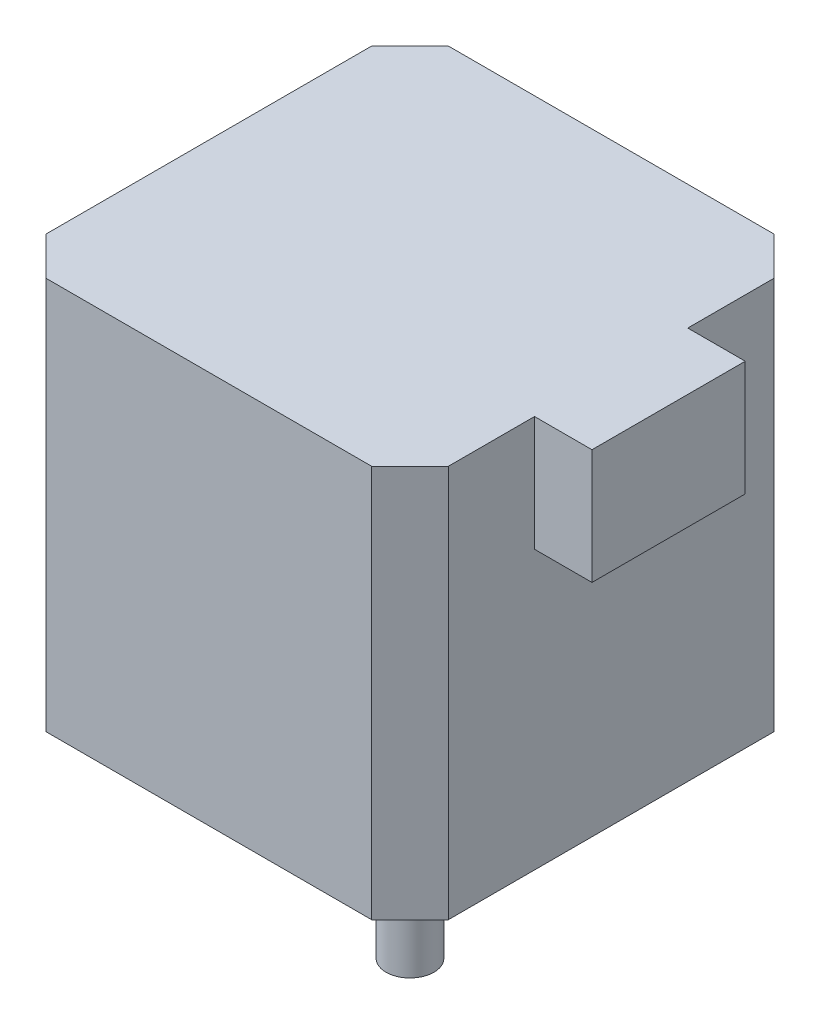
from build123d import *

# Parameters (mm, degrees)
SKETCH1_W                   = 42
SKETCH1_H                   = 42
BOSS_EXTRUDE1_DEPTH         = 41
CHAMFER1_SIZE               = 4
SKETCH2_R                   = 11
BOSS_EXTRUDE2_DEPTH         = 1.7
SKETCH3_R                   = 2.5
BOSS_EXTRUDE3_DEPTH         = 22.5
SKETCH4_W                   = 16
SKETCH4_H                   = 12
BOSS_EXTRUDE4_DEPTH         = 6
TAP_DRILL_FOR_M3_TAP1_D     = 2.5
TAP_DRILL_FOR_M3_TAP1_DEPTH = 8
TAP_DRILL_FOR_M3_TAP1_TIP   = 0.751075774


with BuildPart() as part:
    # Sketch1 → Boss-Extrude1 (new body)
    with BuildSketch(Plane(origin=(0, 0, 0), x_dir=(1, 0, 0), z_dir=(0, 1, 0))):
        Rectangle(SKETCH1_W, SKETCH1_H)
    extrude(amount=BOSS_EXTRUDE1_DEPTH)

    # Chamfer1
    chamfer1_edges = [part.edges().sort_by_distance(p)[0] for p in [
        (21, 20.5, 21),
        (-21, 20.5, 21),
        (-21, 20.5, -21),
        (21, 20.5, -21),
    ]]
    chamfer(chamfer1_edges, length=CHAMFER1_SIZE)

    # Sketch2 → Boss-Extrude2 (add)
    with BuildSketch(Plane(origin=(0, 0, 0), x_dir=(1, 0, 0), z_dir=(0, 1, 0))):
        with Locations(Location((0, 0, 0), (0, 0, 270))):
            Circle(SKETCH2_R)
    extrude(amount=-BOSS_EXTRUDE2_DEPTH)

    # Sketch3 → Boss-Extrude3 (add)
    with BuildSketch(Plane(origin=(0, 0, 0), x_dir=(1, 0, 0), z_dir=(0, 1, 0))):
        with Locations(Location((0, 0, 0), (0, 0, 270))):
            Circle(SKETCH3_R)
    extrude(amount=-BOSS_EXTRUDE3_DEPTH)

    # Sketch4 → Boss-Extrude4 (add)
    with BuildSketch(Plane(origin=(21, 0, 0), x_dir=(0, 0, -1), z_dir=(1, 0, 0))):
        with Locations((0, 35)):
            Rectangle(SKETCH4_W, SKETCH4_H)
    extrude(amount=BOSS_EXTRUDE4_DEPTH)

    # Tap Drill for M3 Tap1
    with Locations(Plane(origin=(0, 0, 0), x_dir=(-1, 0, 0), z_dir=(0, -1, 0))):
        with Locations((-15.5, -15.5), (15.5, -15.5), (15.5, 15.5), (-15.5, 15.5)):
            Hole(TAP_DRILL_FOR_M3_TAP1_D / 2, depth=TAP_DRILL_FOR_M3_TAP1_DEPTH)
            with Locations((0, 0, -(TAP_DRILL_FOR_M3_TAP1_DEPTH + TAP_DRILL_FOR_M3_TAP1_TIP / 2))):  # 118° drill point
                Cone(0, TAP_DRILL_FOR_M3_TAP1_D / 2, TAP_DRILL_FOR_M3_TAP1_TIP, mode=Mode.SUBTRACT)


solid = part.part
